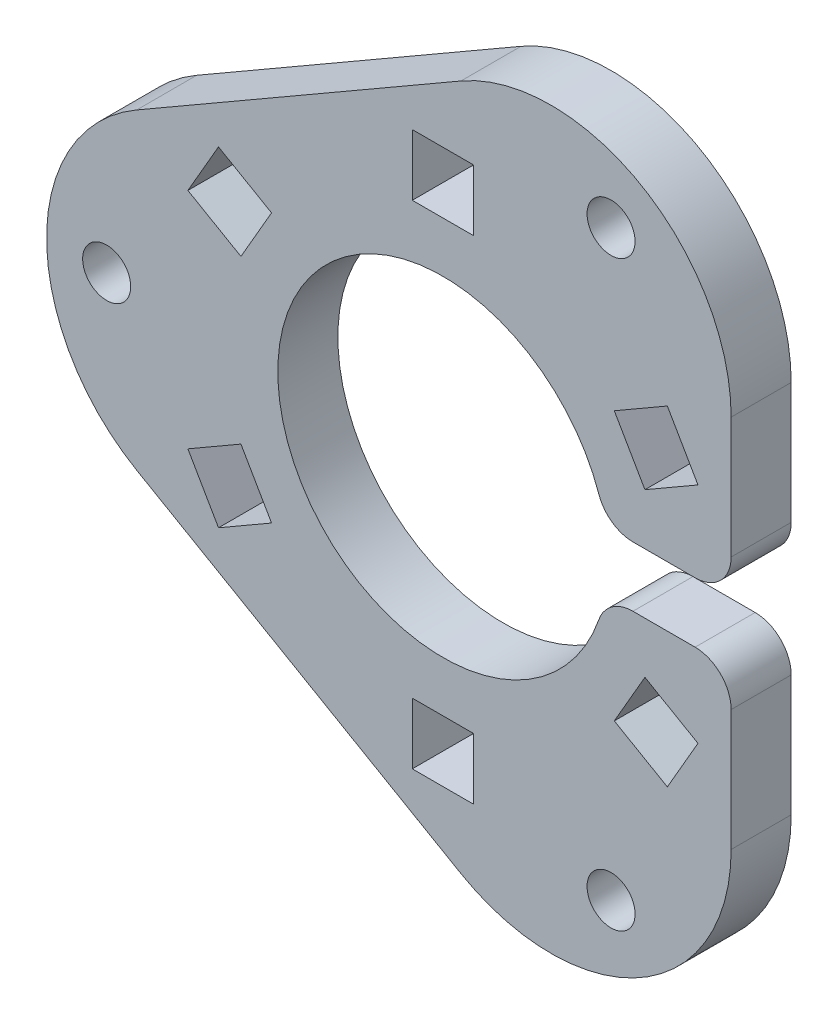
from build123d import *

# Parameters (mm, degrees)
SKETCH1_R           = 2
SKETCH1_W           = 5.1
SKETCH1_H           = 5.1
BOSS_EXTRUDE1_DEPTH = 5
CONG_1_R            = 15
CONG_2_R            = 3


with BuildPart() as part:
    # Sketch1 → Boss-Extrude1 (new body)
    with BuildSketch(Plane.XY):
        with BuildLine():
            Line((24, 2.5), (13.520817283, 2.5))
            ThreePointArc((13.520817283, 2.5), (-13.75, 0), (13.520817283, -2.5))
            Line((13.520817283, -2.5), (24, -2.5))
            Line((24, -2.5), (24, -41.569219382))
            Line((24, -41.569219382), (-48, 0))
            Line((-48, 0), (24, 41.569219382))
            Line((24, 41.569219382), (24, 2.5))
        make_face()
        with Locations((14, 24.248711306)):
            Circle(SKETCH1_R, mode=Mode.SUBTRACT)
        with Locations((14, -24.248711306)):
            Circle(SKETCH1_R, mode=Mode.SUBTRACT)
        with Locations((-28, 0)):
            Circle(SKETCH1_R, mode=Mode.SUBTRACT)
        with Locations((0, 20.5)):
            Rectangle(SKETCH1_W, SKETCH1_H, mode=Mode.SUBTRACT)
        Polygon((21.236885557, 9.31663522), (16.820155998, 6.76663522), (14.270155998, 11.18336478), (18.686885557, 13.73336478), align=None, mode=Mode.SUBTRACT)
        Polygon((18.686885557, -13.73336478), (14.270155998, -11.18336478), (16.820155998, -6.76663522), (21.236885557, -9.31663522), align=None, mode=Mode.SUBTRACT)
        with Locations((0, -20.5)):
            Rectangle(SKETCH1_W, SKETCH1_H, mode=Mode.SUBTRACT)
        Polygon((-21.236885557, -9.31663522), (-16.820155998, -6.76663522), (-14.270155998, -11.18336478), (-18.686885557, -13.73336478), align=None, mode=Mode.SUBTRACT)
        Polygon((-18.686885557, 13.73336478), (-14.270155998, 11.18336478), (-16.820155998, 6.76663522), (-21.236885557, 9.31663522), align=None, mode=Mode.SUBTRACT)
    extrude(amount=BOSS_EXTRUDE1_DEPTH)

    # Congé1
    cong_1_edges = [part.edges().sort_by_distance(p)[0] for p in [
        (24, -41.569219382, 2.5),
        (-48, 0, 2.5),
        (24, 41.569219382, 2.5),
    ]]
    fillet(cong_1_edges, radius=CONG_1_R)

    # Congé2
    cong_2_edges = [part.edges().sort_by_distance(p)[0] for p in [
        (24, 2.5, 2.5),
        (13.520817283, 2.5, 2.5),
        (13.520817283, -2.5, 2.5),
        (24, -2.5, 2.5),
    ]]
    fillet(cong_2_edges, radius=CONG_2_R)


solid = part.part
